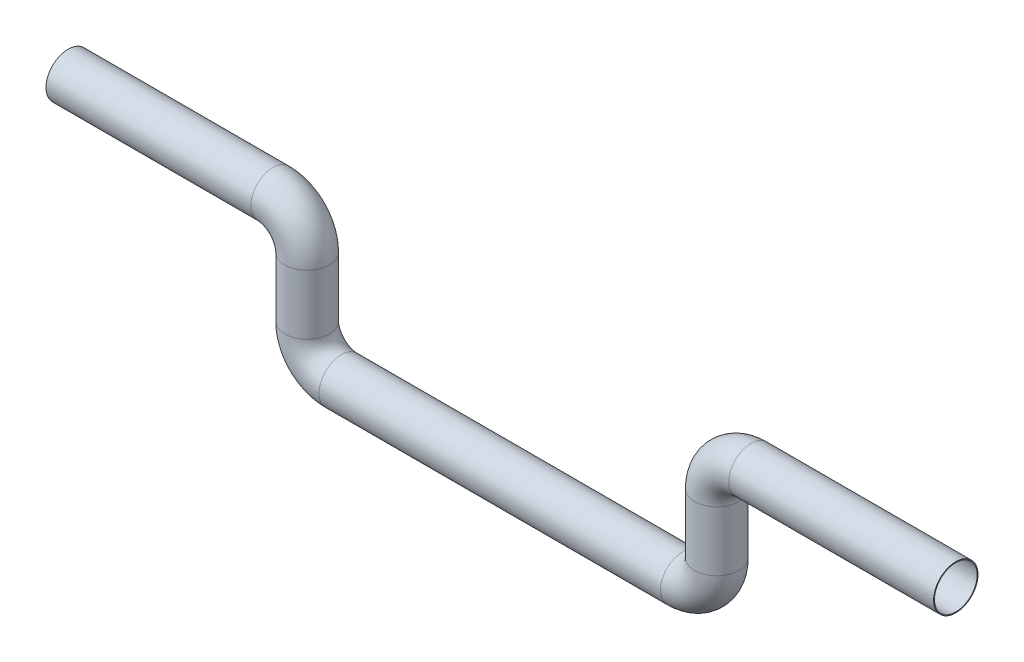
from build123d import *

# Parameters (mm, degrees)
SKETCH3_R   = 13
SKETCH3_R_2 = 12.5


with BuildPart() as part:
    # Sweep1: sweep along a path in Sketch2
    with BuildLine(Plane.XY) as sweep1_path:
        Line((0, 0), (100, 0))
        ThreePointArc((100, 0), (114.142135624, 5.857864376), (120, 20))
        Line((120, 20), (120, 55))
        ThreePointArc((120, 55), (125.857864376, 69.142135624), (140, 75))
        Line((140, 75), (260, 75))
    # Sketch3 → Sweep1 (sweep)
    with BuildSketch(Plane(origin=(0, 0, 0), x_dir=(0, 0, -1), z_dir=(1, 0, 0))):
        Circle(SKETCH3_R)
        Circle(SKETCH3_R_2, mode=Mode.SUBTRACT)
    sweep(path=sweep1_path.line)

    # Mirror2: part across plane


with BuildPart() as part_1:
    add(part.part)
    add(part.part.mirror(Plane(origin=(0, 0, 0), x_dir=(0, 0, 1), z_dir=(1, 0, 0))))


solid = part_1.part
